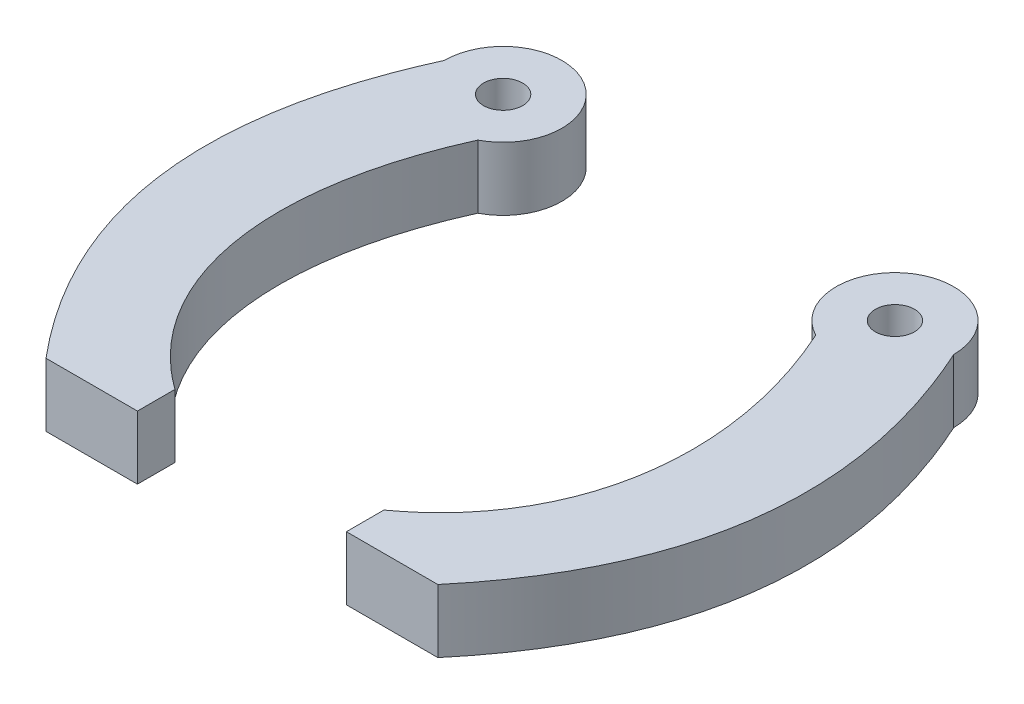
from build123d import *

# Parameters (mm, degrees)
SKETCH1_R   = 9
SKETCH1_R_2 = 3
JAW_DEPTH   = 9.7


with BuildPart() as part:
    # Sketch1 → JAW (new body)
    # profile 1 of 4: a face of its own
    with BuildSketch(Plane(origin=(0, 0, 0), x_dir=(1, 0, 0), z_dir=(0, 1, 0))):
        with BuildLine():
            Line((-30, -70), (-16, -70))
            Line((-16, -70), (-16, -64.254362193))
            add(Edge.make_bspline(
                [(-25.876894374, -8), (-36.148198027, -30.767441184), (-32.463039253, -52.37682767), (-16, -64.254362193)],
                knots=[0.085368469, 0.085368469, 0.085368469, 0.085368469, 0.851547731, 0.851547731, 0.851547731, 0.851547731], degree=3))
            ThreePointArc((-25.876894374, -8), (-34.684658438, -7.684658438), (-39, 0))
            add(Edge.make_bspline(
                [(-30, -70), (-56.532080268, -38.496296341), (-39, 0)],
                knots=[0, 0, 0, 1, 1, 1], degree=2))
        make_face()
    # profile 2 of 4: a face of its own
    with BuildSketch(Plane(origin=(0, 0, 0), x_dir=(1, 0, 0), z_dir=(0, 1, 0))):
        with Locations((-30, 0)):
            Circle(SKETCH1_R)
        with Locations(Location((-30, 0, 0), (0, 0, 270))):
            Circle(SKETCH1_R_2, mode=Mode.SUBTRACT)
    # profile 3 of 4: a face of its own
    with BuildSketch(Plane(origin=(0, 0, 0), x_dir=(1, 0, 0), z_dir=(0, 1, 0))):
        with BuildLine():
            Line((16, -64.254362193), (16, -70))
            Line((16, -70), (30, -70))
            add(Edge.make_bspline(
                [(30, -70), (56.532080268, -38.496296341), (39, 0)],
                knots=[0, 0, 0, 1, 1, 1], degree=2))
            ThreePointArc((39, 0), (34.684658438, -7.684658438), (25.876894374, -8))
            add(Edge.make_bspline(
                [(25.876894374, -8), (36.148198027, -30.767441184), (32.463039253, -52.37682767), (16, -64.254362193)],
                knots=[0.085368469, 0.085368469, 0.085368469, 0.085368469, 0.851547731, 0.851547731, 0.851547731, 0.851547731], degree=3))
        make_face()
    # profile 4 of 4: a face of its own
    with BuildSketch(Plane(origin=(0, 0, 0), x_dir=(1, 0, 0), z_dir=(0, 1, 0))):
        with Locations((30, 0)):
            Circle(SKETCH1_R)
        with Locations(Location((30, 0, 0), (0, 0, 270))):
            Circle(SKETCH1_R_2, mode=Mode.SUBTRACT)
    extrude(amount=JAW_DEPTH)


solid = part.part
